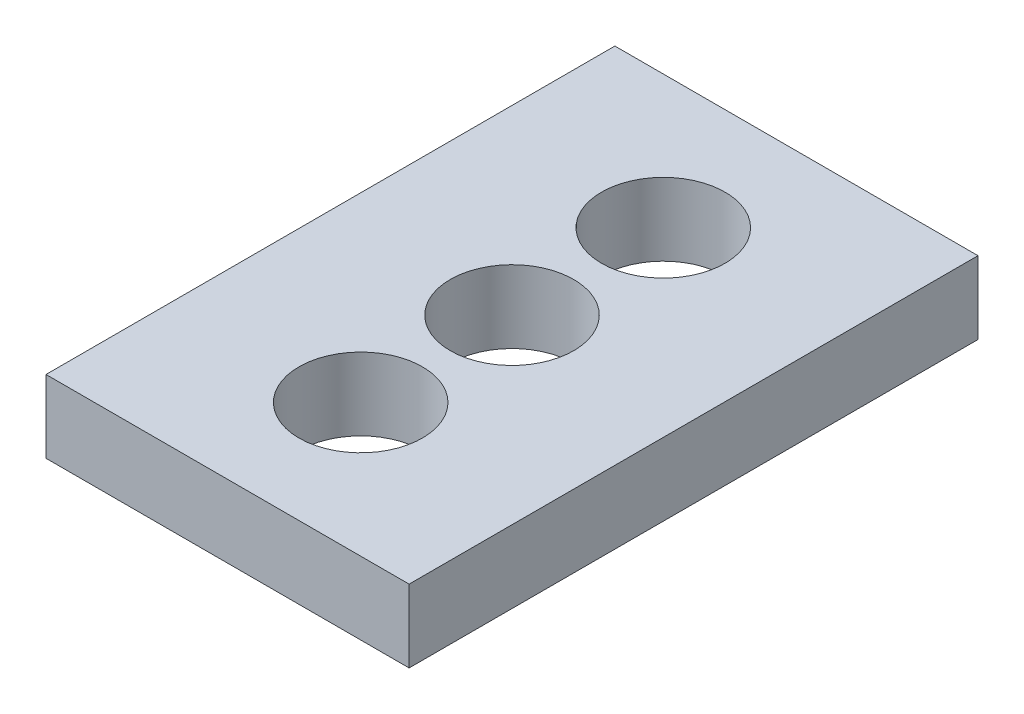
from build123d import *

# Parameters (mm, degrees)
ESBO_O1_W                = 15
ESBO_O1_H                = 23.5
ESBO_O1_R                = 2.55
RESSALTO_EXTRUS_O1_DEPTH = 3


with BuildPart() as part:
    # Esboço1 → Ressalto-extrusão1 (new body)
    with BuildSketch(Plane(origin=(0, 0, 0), x_dir=(1, 0, 0), z_dir=(0, 1, 0))):
        with Locations((-48.09690294, -3.895396601)):
            Rectangle(ESBO_O1_W, ESBO_O1_H)
        with Locations(Location((-48.09690294, 2.354603399, 0), (0, 0, 270))):
            Circle(ESBO_O1_R, mode=Mode.SUBTRACT)
        with Locations(Location((-48.09690294, -3.895396601, 0), (0, 0, 270))):
            Circle(ESBO_O1_R, mode=Mode.SUBTRACT)
        with Locations(Location((-48.09690294, -10.145396601, 0), (0, 0, 270))):
            Circle(ESBO_O1_R, mode=Mode.SUBTRACT)
    extrude(amount=RESSALTO_EXTRUS_O1_DEPTH)


solid = part.part
